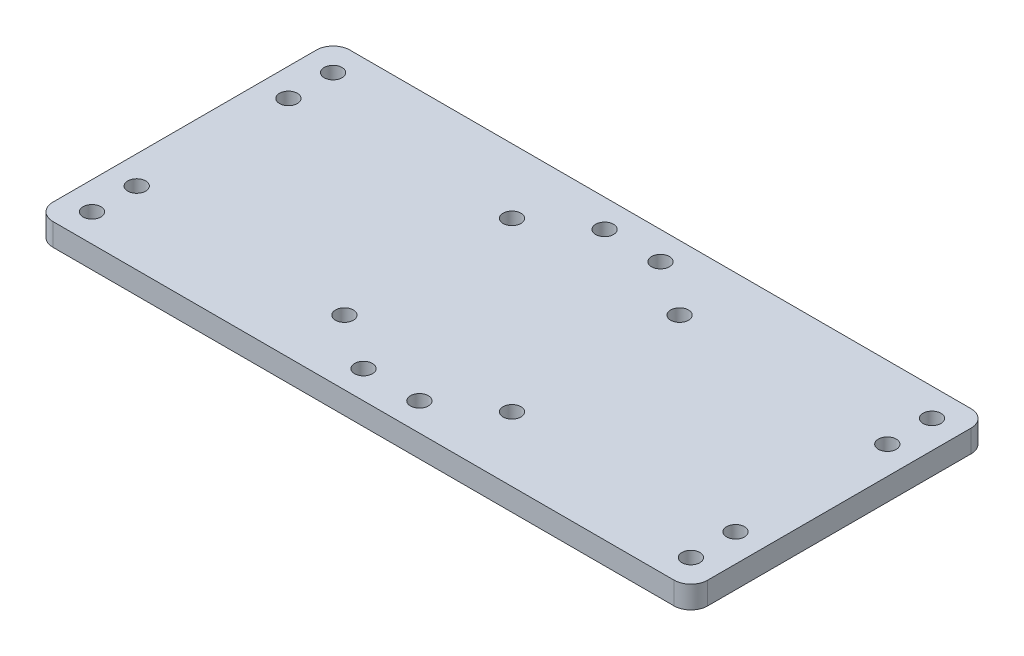
from build123d import *

# Parameters (mm, degrees)
SKETCH_1_W          = 117.2
SKETCH_1_H          = 53.16059175
EXTRUDE_1_DEPTH     = 4
SKETCH_3_R          = 1.6
CUT_EXTRUDE_1_DEPTH = 4
FILLET_1_R          = 3
SKETCH_4_R          = 1.6
CUT_EXTRUDE_2_DEPTH = 10


with BuildPart() as part:
    # 草图1 → 凸台-拉伸1 (new body)
    with BuildSketch(Plane(origin=(0, 0, 0), x_dir=(1, 0, 0), z_dir=(0, 1, 0))):
        Rectangle(SKETCH_1_W, SKETCH_1_H)
    extrude(amount=EXTRUDE_1_DEPTH)

    # 草图3 → 切除-拉伸1 (cut)
    with BuildSketch(Plane(origin=(0, 4, 0), x_dir=(1, 0, 0), z_dir=(0, 1, 0))):
        with Locations(Location((-53.6, -21.580295875, 0), (0, 0, 270))):
            Circle(SKETCH_3_R)
        with Locations(Location((-53.6, -13.580295875, 0), (0, 0, 270))):
            Circle(SKETCH_3_R)
        with Locations(Location((-5, -21.580295875, 0), (0, 0, 270))):
            Circle(SKETCH_3_R)
        with Locations(Location((5, -21.580295875, 0), (0, 0, 90))):
            Circle(SKETCH_3_R)
        with Locations(Location((53.6, -13.580295875, 0), (0, 0, 90))):
            Circle(SKETCH_3_R)
        with Locations(Location((53.6, -21.580295875, 0), (0, 0, 90))):
            Circle(SKETCH_3_R)
        with Locations(Location((-53.6, 13.580295875, 0), (0, 0, 90))):
            Circle(SKETCH_3_R)
        with Locations(Location((-53.6, 21.580295875, 0), (0, 0, 90))):
            Circle(SKETCH_3_R)
        with Locations(Location((-5, 21.580295875, 0), (0, 0, 90))):
            Circle(SKETCH_3_R)
        with Locations(Location((5, 21.580295875, 0), (0, 0, 270))):
            Circle(SKETCH_3_R)
        with Locations(Location((53.6, 21.580295875, 0), (0, 0, 270))):
            Circle(SKETCH_3_R)
        with Locations(Location((53.6, 13.580295875, 0), (0, 0, 270))):
            Circle(SKETCH_3_R)
    extrude(amount=-CUT_EXTRUDE_1_DEPTH, mode=Mode.SUBTRACT)

    # 圆角1
    fillet_1_edges = [part.edges().sort_by_distance(p)[0] for p in [
        (58.6, 2, 26.580295875),
        (-58.6, 2, 26.580295875),
        (-58.6, 2, -26.580295875),
        (58.6, 2, -26.580295875),
    ]]
    fillet(fillet_1_edges, radius=FILLET_1_R)

    # 草图4 → 切除-拉伸2 (cut)
    with BuildSketch(Plane(origin=(0, 4, 0), x_dir=(1, 0, 0), z_dir=(0, 1, 0))):
        with Locations(Location((-15, -15, 0), (0, 0, 270))):
            Circle(SKETCH_4_R)
        with Locations(Location((15, 15, 0), (0, 0, 270))):
            Circle(SKETCH_4_R)
        with Locations(Location((15, -15, 0), (0, 0, 270))):
            Circle(SKETCH_4_R)
        with Locations(Location((-15, 15, 0), (0, 0, 270))):
            Circle(SKETCH_4_R)
    extrude(amount=-CUT_EXTRUDE_2_DEPTH, mode=Mode.SUBTRACT)


solid = part.part
